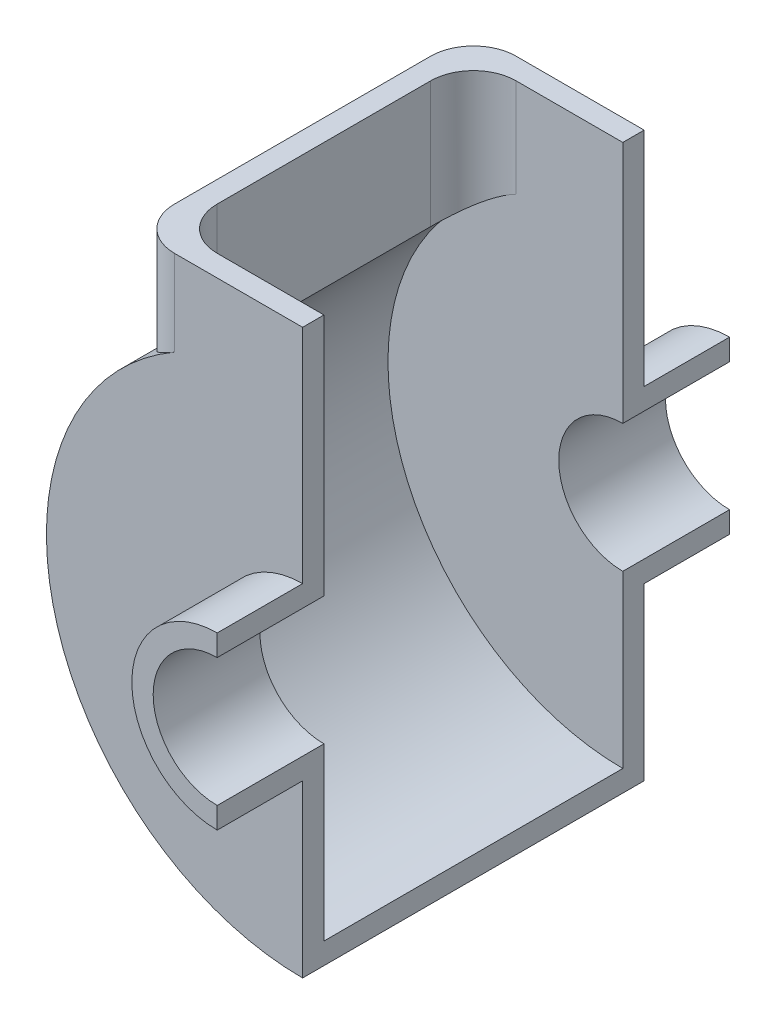
from build123d import *

# Parameters (mm, degrees)
DODANIE_WYCI_GNI_CIE1_DEPTH       = 25
DODANIE_WYCI_GNI_CIE2_DEPTH       = 5
WYCI_GNI_CIE_CIENKA_START         = -70
WYCI_GNI_CIE_CIENKA_CIANKA1_DEPTH = 70
ZAOKR_GLENIE1_R                   = 10


with BuildPart() as part:
    # Szkic1 → Dodanie-wyciągnięcie1 (new body)
    with BuildSketch(Plane.XY):
        with BuildLine():
            Line((0, 15), (0, 20))
            ThreePointArc((0, 20), (-20, 0), (0, -20))
            Line((0, -20), (0, -15))
            ThreePointArc((0, -15), (-15, 0), (0, 15))
        make_face()
    extrude(amount=DODANIE_WYCI_GNI_CIE1_DEPTH)

    # Szkic2 → Dodanie-wyciągnięcie2 (add)
    with BuildSketch(Plane(origin=(0, 0, 0), x_dir=(-1, 0, 0), z_dir=(0, 0, -1))):
        with BuildLine():
            Line((0, 20), (0, 72))
            Line((0, 72), (40, 72))
            Line((40, 72), (40, 44.72135955))
            ThreePointArc((40, 44.72135955), (56.050341538, -21.409325386), (0, -60))
            Line((0, -60), (0, -20))
            ThreePointArc((0, -20), (20, 0), (0, 20))
        make_face()
    extrude(amount=-DODANIE_WYCI_GNI_CIE2_DEPTH)


with BuildPart() as body_2:
    # Lustro2: mirrored copy
    add(part.part.mirror(Plane.XY.offset(-35)))


with BuildPart() as part_1:
    add(part.part)

    add(body_2.part)  # Wyciągnięcie-cienka ścianka1 merges body 2
    # Szkic4 → Wyciągnięcie-cienka ścianka1 (add)
    with BuildSketch(Plane.XY.offset(WYCI_GNI_CIE_CIENKA_START)):
        with BuildLine():
            ThreePointArc((0, -60), (-56.050341538, -21.409325386), (-40, 44.72135955))
            Line((-40, 44.72135955), (-40, 72))
            Line((-40, 72), (-35, 72))
            Line((-35, 72), (-35, 42.426406871))
            ThreePointArc((-35, 42.426406871), (-51.76124215, -18.594994247), (0, -55))
            Line((0, -55), (0, -60))
        make_face()
    extrude(amount=WYCI_GNI_CIE_CIENKA_CIANKA1_DEPTH)

    # Zaokrąglenie1
    zaokr_glenie1_edges = [part_1.edges().sort_by_distance(p)[0] for p in [
        (-40, 58.360679775, 5),
        (-35, 57.213203436, 0),
        (-35, 57.213203436, -70),
        (-40, 58.360679775, -75),
    ]]
    fillet(zaokr_glenie1_edges, radius=ZAOKR_GLENIE1_R)


solid = part_1.part
